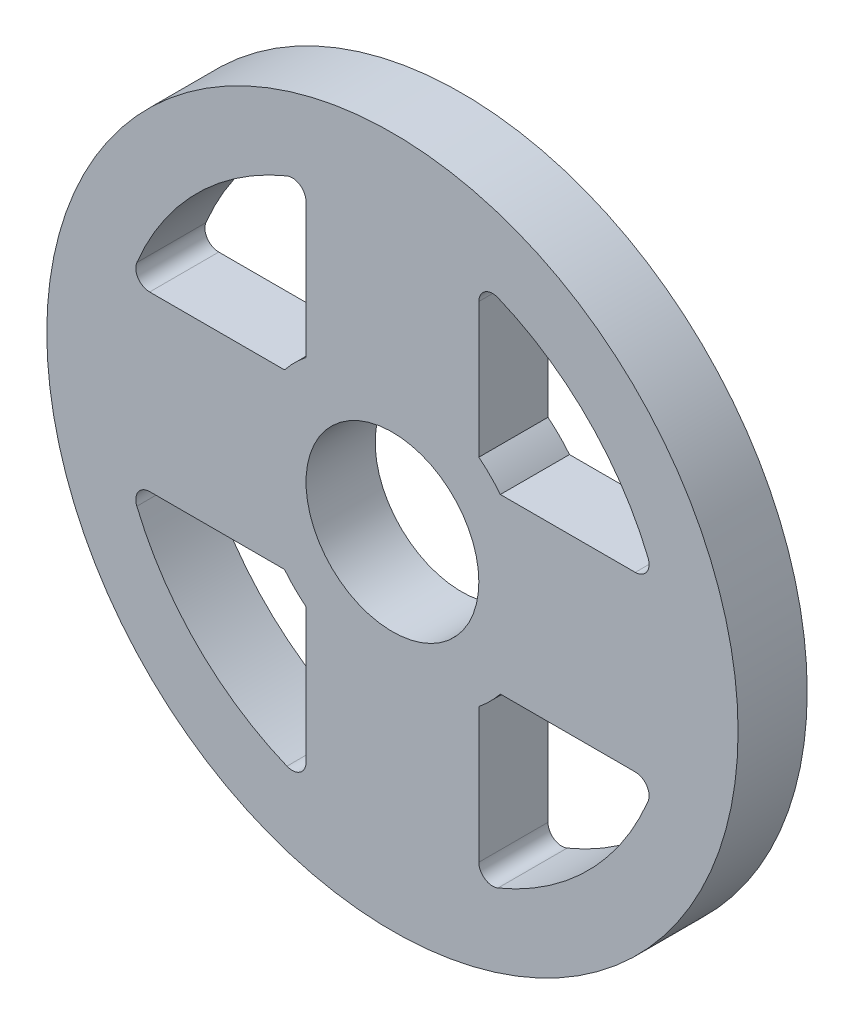
from build123d import *

# Parameters (mm, degrees)
SKETCH1_R           = 25
SKETCH1_R_2         = 10
SKETCH1_R_3         = 6.25
BOSS_EXTRUDE1_DEPTH = 5


with BuildPart() as part:
    # Sketch1 → Boss-Extrude1 (new body)
    # profile 1 of 2: a face of its own
    with BuildSketch(Plane.XY):
        Circle(SKETCH1_R)
        with BuildLine():
            Line((17.56238879, 6.25), (7.806247498, 6.25))
            ThreePointArc((7.806247498, 6.25), (9.43563657, 3.311912214), (10, 0))
            ThreePointArc((10, 0), (9.43563657, -3.311912214), (7.806247498, -6.25))
            Line((7.806247498, -6.25), (17.56238879, -6.25))
            ThreePointArc((17.56238879, -6.25), (18.393526247, -6.693932984), (18.486725042, -7.631578947))
            ThreePointArc((18.486725042, -7.631578947), (14.142135624, -14.142135624), (7.631578947, -18.486725042))
            ThreePointArc((7.631578947, -18.486725042), (6.693932984, -18.393526247), (6.25, -17.56238879))
            Line((6.25, -17.56238879), (6.25, -7.806247498))
            ThreePointArc((6.25, -7.806247498), (0, -10), (-6.25, -7.806247498))
            Line((-6.25, -7.806247498), (-6.25, -17.56238879))
            ThreePointArc((-6.25, -17.56238879), (-6.693932984, -18.393526247), (-7.631578947, -18.486725042))
            ThreePointArc((-7.631578947, -18.486725042), (-14.142135624, -14.142135624), (-18.486725042, -7.631578947))
            ThreePointArc((-18.486725042, -7.631578947), (-18.393526247, -6.693932984), (-17.56238879, -6.25))
            Line((-17.56238879, -6.25), (-7.806247498, -6.25))
            ThreePointArc((-7.806247498, -6.25), (-10, 0), (-7.806247498, 6.25))
            Line((-7.806247498, 6.25), (-17.56238879, 6.25))
            ThreePointArc((-17.56238879, 6.25), (-18.393526247, 6.693932984), (-18.486725042, 7.631578947))
            ThreePointArc((-18.486725042, 7.631578947), (-14.142135624, 14.142135624), (-7.631578947, 18.486725042))
            ThreePointArc((-7.631578947, 18.486725042), (-6.693932984, 18.393526247), (-6.25, 17.56238879))
            Line((-6.25, 17.56238879), (-6.25, 7.806247498))
            ThreePointArc((-6.25, 7.806247498), (0, 10), (6.25, 7.806247498))
            Line((6.25, 7.806247498), (6.25, 17.56238879))
            ThreePointArc((6.25, 17.56238879), (6.693932984, 18.393526247), (7.631578947, 18.486725042))
            ThreePointArc((7.631578947, 18.486725042), (14.142135624, 14.142135624), (18.486725042, 7.631578947))
            ThreePointArc((18.486725042, 7.631578947), (18.393526247, 6.693932984), (17.56238879, 6.25))
        make_face(mode=Mode.SUBTRACT)
    # profile 2 of 2: a face of its own
    with BuildSketch(Plane.XY):
        Circle(SKETCH1_R_2)
        Circle(SKETCH1_R_3, mode=Mode.SUBTRACT)
    extrude(amount=BOSS_EXTRUDE1_DEPTH)


solid = part.part
